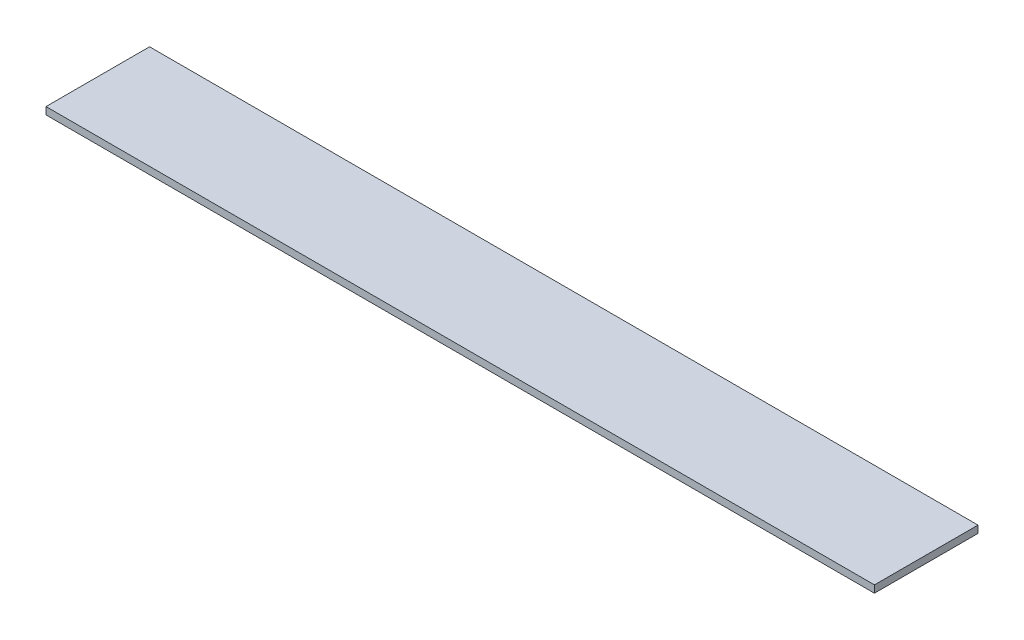
from build123d import *

# Parameters (mm, degrees)
SKETCH1_W           = 80
SKETCH1_H           = 10
BOSS_EXTRUDE1_DEPTH = 0.7


with BuildPart() as part:
    # Sketch1 → Boss-Extrude1 (new body)
    with BuildSketch(Plane(origin=(0, 0, 0), x_dir=(1, 0, 0), z_dir=(0, 1, 0))):
        Rectangle(SKETCH1_W, SKETCH1_H)
    extrude(amount=BOSS_EXTRUDE1_DEPTH)


solid = part.part
